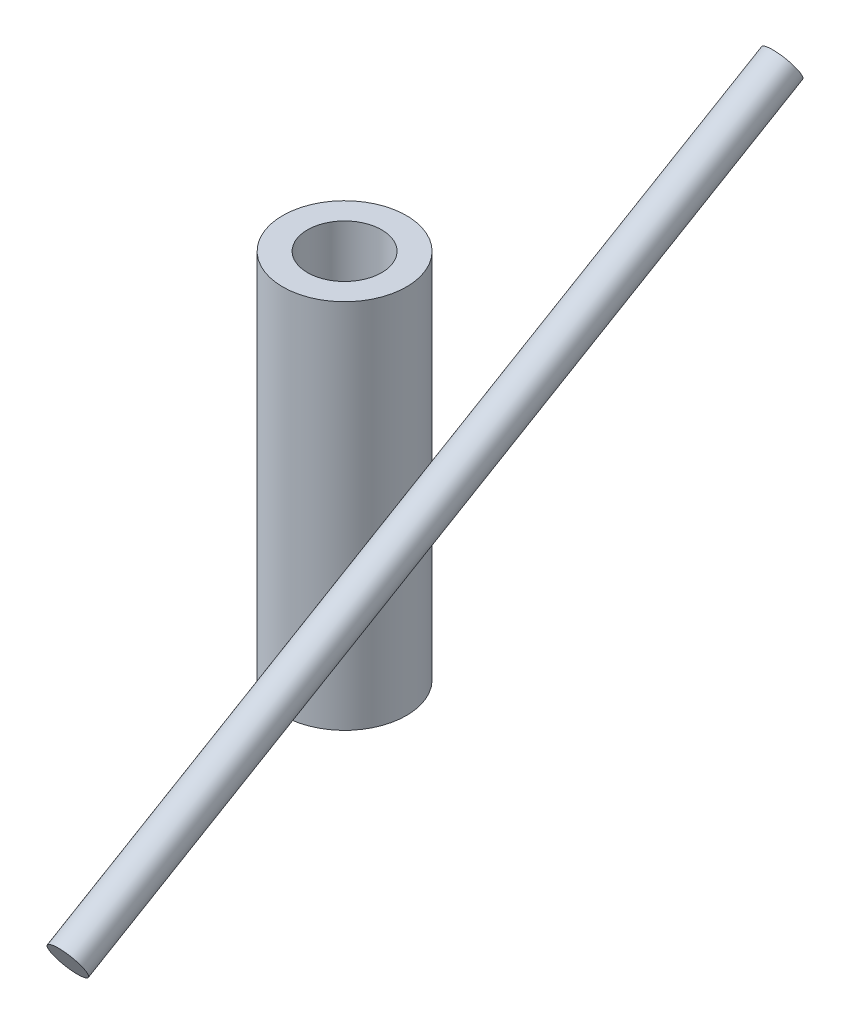
from build123d import *

# Parameters (mm, degrees)
EXTRUDE_1_DEPTH      = 15
EXTRUDE_1_DEPTH_BACK = 15
SKETCH_1_R           = 5
SKETCH_1_R_2         = 3
SKETCH_3_R           = 1.5
SKETCH_4_R           = 2
CUT_EXTRUDE_1_DEPTH  = 15


with BuildPart() as part:
    # Эскиз1 → Бобышка-Вытянуть1 (new, two sides: drawn at the far end of the back side and taken through both)
    with BuildSketch(Plane(origin=(0, 0, 0), x_dir=(1, 0, 0), z_dir=(0, 1, 0)).offset(-EXTRUDE_1_DEPTH_BACK)):
        Circle(SKETCH_1_R)
        Circle(SKETCH_1_R_2, mode=Mode.SUBTRACT)
    extrude(amount=EXTRUDE_1_DEPTH + EXTRUDE_1_DEPTH_BACK)

    # Эскиз4 → Вырез-Вытянуть1 (cut)
    with BuildSketch(Plane(origin=(0, 0, 0), x_dir=(0, 0, -1), z_dir=(1, 0, 0))):
        Circle(SKETCH_4_R)
    extrude(amount=-CUT_EXTRUDE_1_DEPTH, mode=Mode.SUBTRACT)


with BuildPart() as body_2:
    # По траектории1: sweep along a path in Эскиз2
    with BuildLine(Plane(origin=(5, 0, 0), x_dir=(0, 0, -1), z_dir=(1, 0, 0))) as sweep_1_path:
        Line((-28.866070048, -17), (28.866070048, 17))
    # Эскиз3 → По траектории1 (sweep)
    with BuildSketch(Plane(origin=(5, -17, 28.866070048), x_dir=(-1, 0, 0), z_dir=(0, 0.5074626865671642, -0.8616737327678246))):
        with Locations((-1.5, 0)):
            Circle(SKETCH_3_R)
    sweep(path=sweep_1_path.line)


solid = Compound([part.part, body_2.part])
